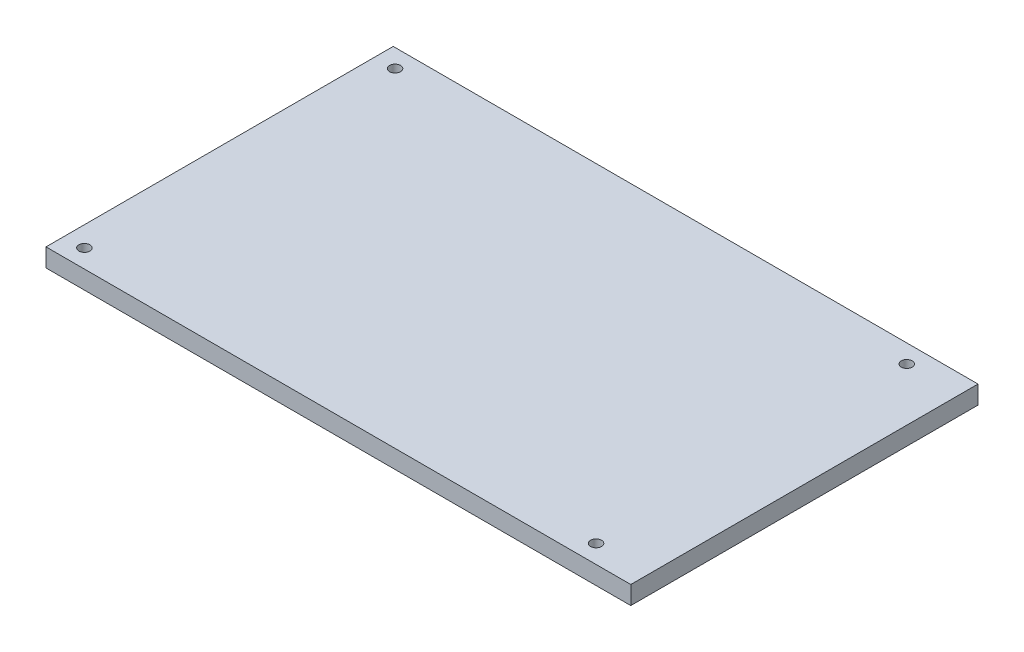
from build123d import *

# Parameters (mm, degrees)
SKETCH_1_W          = 160
SKETCH_1_H          = 95
EXTRUDE_1_DEPTH     = 5
SKETCH_2_R          = 1.5
CUT_EXTRUDE_1_DEPTH = 187.14510469


with BuildPart() as part:
    # 草图1 → 凸台-拉伸1 (new body)
    with BuildSketch(Plane(origin=(0, 0, 0), x_dir=(1, 0, 0), z_dir=(0, 1, 0))):
        with Locations((80, 47.5)):
            Rectangle(SKETCH_1_W, SKETCH_1_H)
    extrude(amount=EXTRUDE_1_DEPTH)

    # 草图2 → 切除-拉伸1 (cut, through all)
    with BuildSketch(Plane(origin=(0, 5, 0), x_dir=(1, 0, 0), z_dir=(0, 1, 0))):
        with Locations(Location((5.5, 90, 0), (0, 0, 270))):
            Circle(SKETCH_2_R)
        with Locations(Location((145.5, 90, 0), (0, 0, 90))):
            Circle(SKETCH_2_R)
        with Locations(Location((145.5, 5, 0), (0, 0, 270))):
            Circle(SKETCH_2_R)
        with Locations(Location((5.5, 5, 0), (0, 0, 90))):
            Circle(SKETCH_2_R)
    extrude(amount=-CUT_EXTRUDE_1_DEPTH, mode=Mode.SUBTRACT)


solid = part.part
